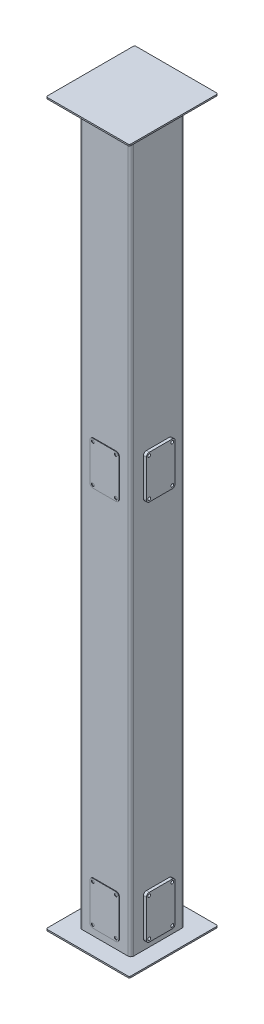
from build123d import *

# Parameters (mm, degrees)
EXTRUDE_1_DEPTH   = 10
EXTRUDE_1_2_DEPTH = 2510
SCALE_1_SCALE     = 0.1
SKETCH_4_R        = 1
EXTRUDE_2_DEPTH   = 2
SKETCH_6_R        = 1
EXTRUDE_3_DEPTH   = 2


with BuildPart() as part:
    # 草图1 → Extrude 1 (new body)
    with BuildSketch(Plane(origin=(0, 0, 0), x_dir=(1, 0, 0), z_dir=(0, 1, 0))):
        with BuildLine():
            Line((-280, 300), (280, 300))
            ThreePointArc((280, 300), (287.071067812, 297.071067812), (290, 290))
            Line((290, 290), (290, -270))
            ThreePointArc((290, -270), (287.071067812, -277.071067812), (280, -280))
            Line((280, -280), (-280, -280))
            ThreePointArc((-280, -280), (-287.071067812, -277.071067812), (-290, -270))
            Line((-290, -270), (-290, 290))
            ThreePointArc((-290, 290), (-287.071067812, 297.071067812), (-280, 300))
        make_face()
    extrude(amount=EXTRUDE_1_DEPTH)

    # 草图3 → Extrude 1 2 (add)
    with BuildSketch(Plane(origin=(0, 0, 0), x_dir=(1, 0, 0), z_dir=(0, 1, 0))):
        with BuildLine():
            Line((-160, 180), (160, 180))
            ThreePointArc((160, 180), (174.142135624, 174.142135624), (180, 160))
            Line((180, 160), (180, -160))
            ThreePointArc((180, -160), (174.142135624, -174.142135624), (160, -180))
            Line((160, -180), (-160, -180))
            ThreePointArc((-160, -180), (-174.142135624, -174.142135624), (-180, -160))
            Line((-180, -160), (-180, 160))
            ThreePointArc((-180, 160), (-174.142135624, 174.142135624), (-160, 180))
        make_face()
        with BuildLine():
            Line((-160, 170), (160, 170))
            ThreePointArc((160, 170), (167.071067812, 167.071067812), (170, 160))
            Line((170, 160), (170, -160))
            ThreePointArc((170, -160), (167.071067812, -167.071067812), (160, -170))
            Line((160, -170), (-160, -170))
            ThreePointArc((-160, -170), (-167.071067812, -167.071067812), (-170, -160))
            Line((-170, -160), (-170, 160))
            ThreePointArc((-170, 160), (-167.071067812, 167.071067812), (-160, 170))
        make_face(mode=Mode.SUBTRACT)
    extrude(amount=EXTRUDE_1_2_DEPTH)

    # 镜向1: part across plane


with BuildPart() as part_1:
    add(part.part)
    add(part.part.mirror(Plane(origin=(-160, 2510, 160), x_dir=(0, 0, 1), z_dir=(0, 1, 0))))


with BuildPart() as part_2:
    # 缩放比例1: scaled about (0, 2510, -0.891622691)
    add(part_1.part.scale(SCALE_1_SCALE).moved(Location((0, 2259, -0.802460422))))

    # 草图4 → 凸台-拉伸2 (add)
    # profile 1 of 2: a face of its own
    with BuildSketch(Plane.XY.offset(17.197539578)):
        with BuildLine():
            Line((10, 2293), (10, 2267))
            ThreePointArc((10, 2267), (9.414213562, 2265.585786438), (8, 2265))
            Line((8, 2265), (-8, 2265))
            ThreePointArc((-8, 2265), (-9.414213562, 2265.585786438), (-10, 2267))
            Line((-10, 2267), (-10, 2293))
            ThreePointArc((-10, 2293), (-9.414213562, 2294.414213562), (-8, 2295))
            Line((-8, 2295), (8, 2295))
            ThreePointArc((8, 2295), (9.414213562, 2294.414213562), (10, 2293))
        make_face()
        with Locations((-8, 2267)):
            Circle(SKETCH_4_R, mode=Mode.SUBTRACT)
        with Locations((8, 2293)):
            Circle(SKETCH_4_R, mode=Mode.SUBTRACT)
        with Locations((-8, 2293)):
            Circle(SKETCH_4_R, mode=Mode.SUBTRACT)
        with Locations((8, 2267)):
            Circle(SKETCH_4_R, mode=Mode.SUBTRACT)
    # profile 2 of 2: a face of its own
    with BuildSketch(Plane.XY.offset(17.197539578)):
        with BuildLine():
            Line((-10, 2558), (-10, 2532))
            ThreePointArc((-10, 2532), (-9.414213562, 2530.585786438), (-8, 2530))
            Line((-8, 2530), (8, 2530))
            ThreePointArc((8, 2530), (9.414213562, 2530.585786438), (10, 2532))
            Line((10, 2532), (10, 2558))
            ThreePointArc((10, 2558), (9.414213562, 2559.414213562), (8, 2560))
            Line((8, 2560), (-8, 2560))
            ThreePointArc((-8, 2560), (-9.414213562, 2559.414213562), (-10, 2558))
        make_face()
        with Locations((8, 2558)):
            Circle(SKETCH_4_R, mode=Mode.SUBTRACT)
        with Locations((8, 2532)):
            Circle(SKETCH_4_R, mode=Mode.SUBTRACT)
        with Locations((-8, 2558)):
            Circle(SKETCH_4_R, mode=Mode.SUBTRACT)
        with Locations((-8, 2532)):
            Circle(SKETCH_4_R, mode=Mode.SUBTRACT)
    extrude(amount=EXTRUDE_2_DEPTH)

    # 镜向2: part across plane


with BuildPart() as part_3:
    add(part_2.part)
    add(part_2.part.mirror(Plane.XY))

    # 草图6 → 凸台-拉伸3 (add)
    # profile 1 of 2: a face of its own
    with BuildSketch(Plane(origin=(18, 0, 0), x_dir=(0, 0, -1), z_dir=(1, 0, 0))):
        with BuildLine():
            Line((-8, 2530), (8, 2530))
            ThreePointArc((8, 2530), (9.414213562, 2530.585786438), (10, 2532))
            Line((10, 2532), (10, 2558))
            ThreePointArc((10, 2558), (9.414213562, 2559.414213562), (8, 2560))
            Line((8, 2560), (-8, 2560))
            ThreePointArc((-8, 2560), (-9.414213562, 2559.414213562), (-10, 2558))
            Line((-10, 2558), (-10, 2532))
            ThreePointArc((-10, 2532), (-9.414213562, 2530.585786438), (-8, 2530))
        make_face()
        with Locations((-8, 2532)):
            Circle(SKETCH_6_R, mode=Mode.SUBTRACT)
        with Locations((-8, 2558)):
            Circle(SKETCH_6_R, mode=Mode.SUBTRACT)
        with Locations((8, 2532)):
            Circle(SKETCH_6_R, mode=Mode.SUBTRACT)
        with Locations((8, 2558)):
            Circle(SKETCH_6_R, mode=Mode.SUBTRACT)
    # profile 2 of 2: a face of its own
    with BuildSketch(Plane(origin=(18, 0, 0), x_dir=(0, 0, -1), z_dir=(1, 0, 0))):
        with BuildLine():
            Line((-8, 2295), (8, 2295))
            ThreePointArc((8, 2295), (9.414213562, 2294.414213562), (10, 2293))
            Line((10, 2293), (10, 2267))
            ThreePointArc((10, 2267), (9.414213562, 2265.585786438), (8, 2265))
            Line((8, 2265), (-8, 2265))
            ThreePointArc((-8, 2265), (-9.414213562, 2265.585786438), (-10, 2267))
            Line((-10, 2267), (-10, 2293))
            ThreePointArc((-10, 2293), (-9.414213562, 2294.414213562), (-8, 2295))
        make_face()
        with Locations((8, 2267)):
            Circle(SKETCH_6_R, mode=Mode.SUBTRACT)
        with Locations((-8, 2293)):
            Circle(SKETCH_6_R, mode=Mode.SUBTRACT)
        with Locations((-8, 2267)):
            Circle(SKETCH_6_R, mode=Mode.SUBTRACT)
        with Locations((8, 2293)):
            Circle(SKETCH_6_R, mode=Mode.SUBTRACT)
    extrude_3 = extrude(amount=EXTRUDE_3_DEPTH)

    # 镜向3: 凸台-拉伸3 across plane
    add(extrude_3.mirror(Plane(origin=(0, 0, 0), x_dir=(0, 0, 1), z_dir=(1, 0, 0))))


solid = part_3.part
